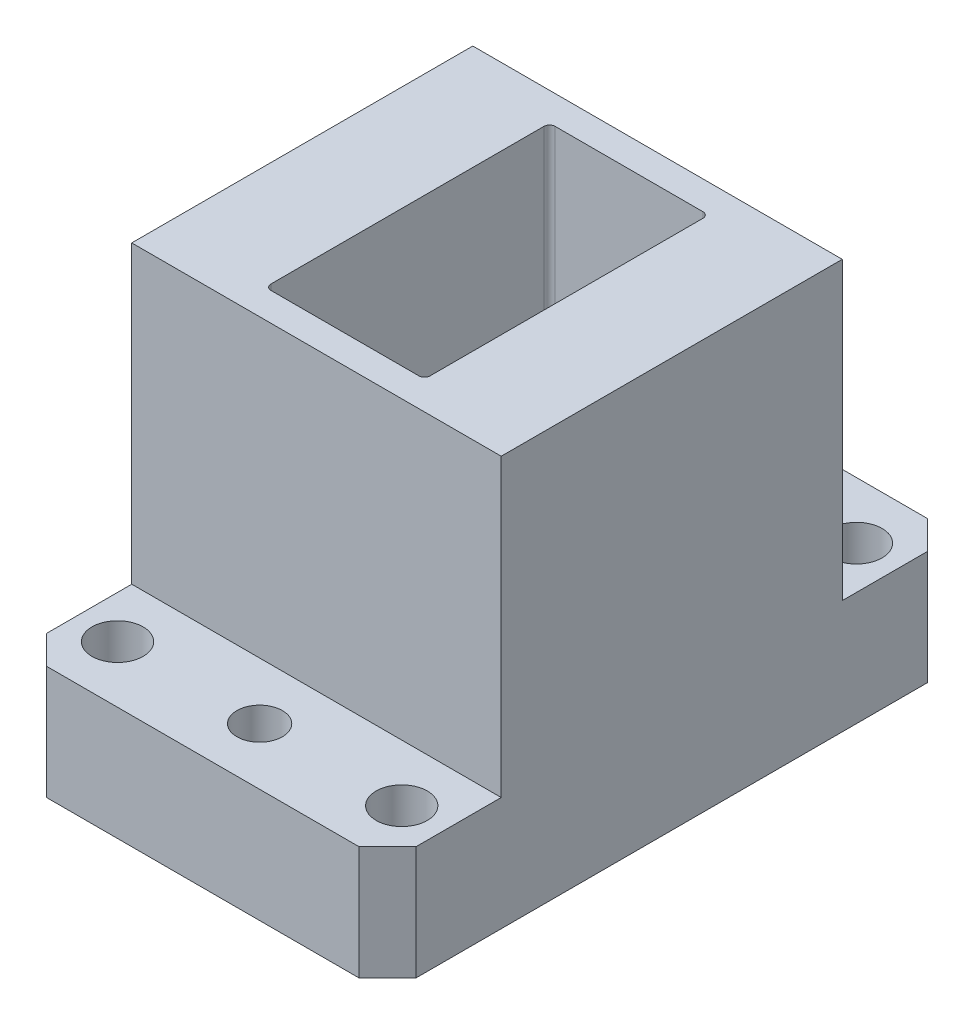
from build123d import *

# Parameters (mm, degrees)
SKETCH_1_W            = 65
SKETCH_1_H            = 72
EXTRUDE_1_DEPTH       = 50
SKETCH_2_W            = 28
SKETCH_2_H            = 50
CUT_EXTRUDE_1_DEPTH   = 94.489304201
SKETCH_4_W            = 65
SKETCH_4_H            = 20
CUT_EXTRUDE_3_DEPTH   = 52
CHAMFER_1_SIZE        = 5
HOLE_WIZARD_9_0_9_1_D = 9
HOLE_WIZARD_8_0_8_1_D = 8
FILLET_1_R            = 1


with BuildPart() as part:
    # 草圖1 → 伸長1 (new, symmetric)
    with BuildSketch(Plane.XY):
        Rectangle(SKETCH_1_W, SKETCH_1_H)
    extrude(amount=EXTRUDE_1_DEPTH, both=True)

    # 草圖2 → 除料-伸長1 (cut, through all)
    with BuildSketch(Plane(origin=(0, 36, 0), x_dir=(1, 0, 0), z_dir=(0, 1, 0))):
        Rectangle(SKETCH_2_W, SKETCH_2_H)
    extrude(amount=-CUT_EXTRUDE_1_DEPTH, mode=Mode.SUBTRACT)

    # 草圖4 → 除料-伸長3 (cut)
    with BuildSketch(Plane(origin=(0, 36, 0), x_dir=(1, 0, 0), z_dir=(0, 1, 0))):
        with Locations((0, -40)):
            Rectangle(SKETCH_4_W, SKETCH_4_H)
        with Locations((0, 40)):
            Rectangle(SKETCH_4_W, SKETCH_4_H)
    extrude(amount=-CUT_EXTRUDE_3_DEPTH, mode=Mode.SUBTRACT)

    # 導角1
    chamfer_1_edges = [part.edges().sort_by_distance(p)[0] for p in [
        (32.5, -26, 50),
        (-32.5, -26, 50),
        (-32.5, -26, -50),
        (32.5, -26, -50),
    ]]
    chamfer(chamfer_1_edges, length=CHAMFER_1_SIZE)

    # Ø9.0 (9) 直徑孔1 (through all)
    with Locations(Plane(origin=(0, -16, 0), x_dir=(-1, 0, 0), z_dir=(0, 1, 0))):
        with Locations((25, -40), (-25, -40), (-25, 40), (25, 40)):
            Hole(HOLE_WIZARD_9_0_9_1_D / 2)

    # Ø8.0 (8) 直徑孔1 (through all)
    with Locations(Plane(origin=(0, -16, 0), x_dir=(-1, 0, 0), z_dir=(0, 1, 0))):
        with Locations((0, -40), (0, 40)):
            Hole(HOLE_WIZARD_8_0_8_1_D / 2)

    # 圓角1
    fillet_1_edges = [part.edges().sort_by_distance(p)[0] for p in [
        (-14, 0, 25),
        (-14, 0, -25),
        (14, 0, -25),
        (14, 0, 25),
    ]]
    fillet(fillet_1_edges, radius=FILLET_1_R)


solid = part.part
